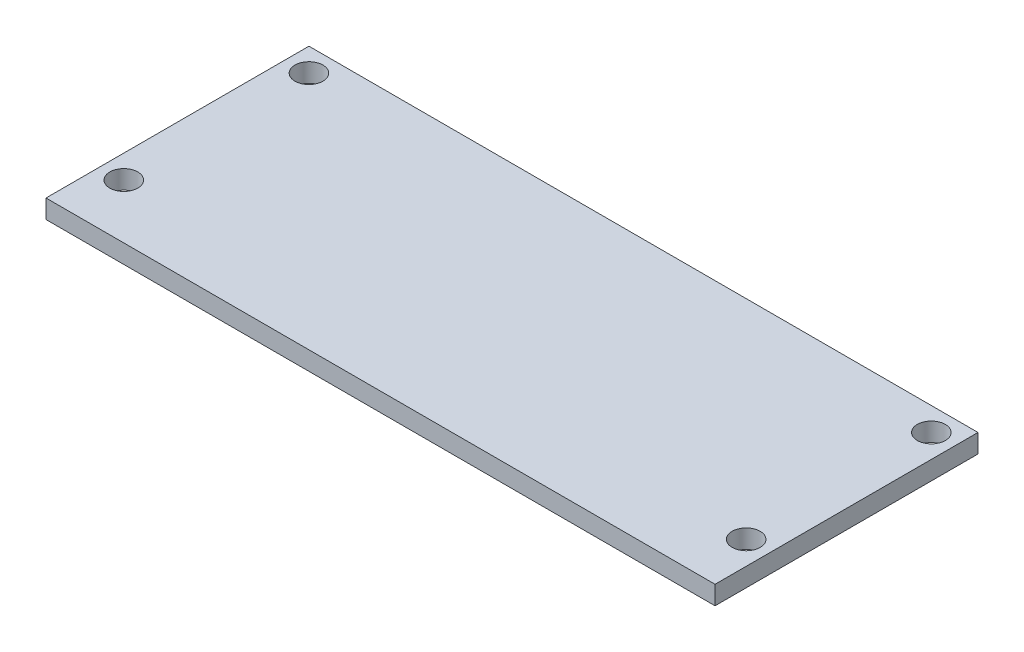
from build123d import *

# Parameters (mm, degrees)
SKETCH1_W           = 430
SKETCH1_H           = 169
BOSS_EXTRUDE1_DEPTH = 12
SKETCH2_R           = 9
CUT_EXTRUDE1_DEPTH  = 12


with BuildPart() as part:
    # Sketch1 → Boss-Extrude1 (new body)
    with BuildSketch(Plane(origin=(0, 0, 0), x_dir=(1, 0, 0), z_dir=(0, 1, 0))):
        with Locations((215, -84.5)):
            Rectangle(SKETCH1_W, SKETCH1_H)
    extrude(amount=BOSS_EXTRUDE1_DEPTH)

    # Sketch2 → Cut-Extrude1 (cut)
    with BuildSketch(Plane(origin=(0, 12, 0), x_dir=(1, 0, 0), z_dir=(0, 1, 0))):
        with Locations((15, -15)):
            Circle(SKETCH2_R)
        with Locations((15, -134)):
            Circle(SKETCH2_R)
        with Locations((415, -134)):
            Circle(SKETCH2_R)
        with Locations((415, -15)):
            Circle(SKETCH2_R)
    extrude(amount=-CUT_EXTRUDE1_DEPTH, mode=Mode.SUBTRACT)


solid = part.part
